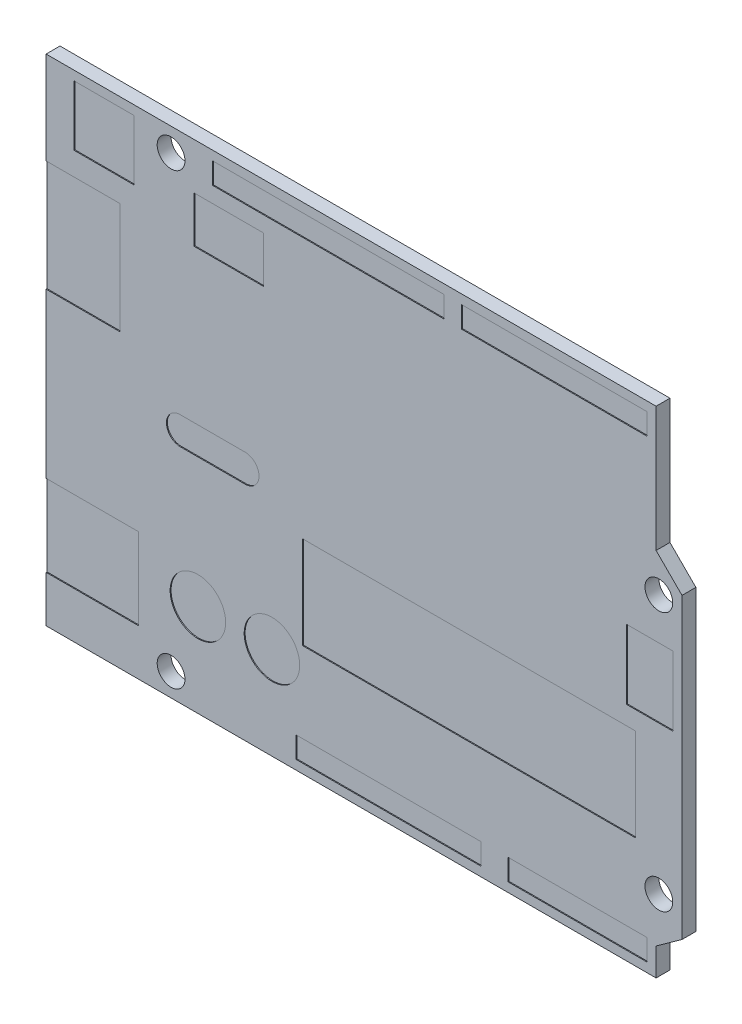
from build123d import *

# Parameters (mm, degrees)
ESQUISSE1_R             = 1.5
BOSS_EXTRU_1_DEPTH      = 1.5
ESQUISSE2_R             = 3
ESQUISSE2_W             = 6.5
ESQUISSE2_H             = 6.5
ESQUISSE2_W_2           = 36
ESQUISSE2_H_2           = 10
ESQUISSE2_W_3           = 5
ESQUISSE2_H_3           = 7.5
ESQUISSE2_W_4           = 20
ESQUISSE2_H_4           = 2.3
ESQUISSE2_W_5           = 15
ESQUISSE2_W_6           = 10.797288279
ESQUISSE2_H_5           = 8.8
ESQUISSE2_W_7           = 11.916291933
ESQUISSE2_H_6           = 12
ESQUISSE2_W_8           = 25
ESQUISSE2_W_9           = 7.5
ESQUISSE2_H_7           = 5
ENL_V_MAT_EXTRU_1_DEPTH = 0.1


with BuildPart() as part:
    # Esquisse1 → Boss.-Extru.1 (new body)
    with BuildSketch(Plane.XY):
        Polygon((35.75, 10.45), (35.75, -21.75), (32.95, -23.75), (32.95, -26.75), (-32.95, -26.75), (-32.95, 26.75), (32.95, 26.75), (32.95, 13.25), align=None)
        with Locations((33.25, 9.25)):
            Circle(ESQUISSE1_R, mode=Mode.SUBTRACT)
        with Locations((33.25, -18.75)):
            Circle(ESQUISSE1_R, mode=Mode.SUBTRACT)
        with Locations((-19.45, 24.25)):
            Circle(ESQUISSE1_R, mode=Mode.SUBTRACT)
        with Locations(Location((-19.45, -24.25, 0), (0, 0, 180))):
            Circle(ESQUISSE1_R, mode=Mode.SUBTRACT)
    extrude(amount=BOSS_EXTRU_1_DEPTH)

    # Esquisse2 → Enlèv. mat.-Extru.1 (cut)
    with BuildSketch(Plane.XY.offset(1.5)):
        with Locations((-16.55, -16.75)):
            Circle(ESQUISSE2_R)
        with Locations((-8.55, -16.75)):
            Circle(ESQUISSE2_R)
        with Locations((-26.7, 22.5)):
            Rectangle(ESQUISSE2_W, ESQUISSE2_H)
        with BuildLine():
            Line((-18.45, 0.25), (-11.45, 0.25))
            ThreePointArc((-11.45, 0.25), (-9.95, -1.25), (-11.45, -2.75))
            Line((-11.45, -2.75), (-18.45, -2.75))
            ThreePointArc((-18.45, -2.75), (-19.95, -1.25), (-18.45, 0.25))
        make_face()
        with Locations((12.75, -9.75)):
            Rectangle(ESQUISSE2_W_2, ESQUISSE2_H_2)
        with Locations((32.25, 1)):
            Rectangle(ESQUISSE2_W_3, ESQUISSE2_H_3)
        with Locations((4.05, -24.6)):
            Rectangle(ESQUISSE2_W_4, ESQUISSE2_H_4)
        with Locations((24.45, -24.6)):
            Rectangle(ESQUISSE2_W_5, ESQUISSE2_H_4)
        with Locations((-28.34864414, -17.35)):
            Rectangle(ESQUISSE2_W_6, ESQUISSE2_H_5)
        with Locations((-30.908145967, 10.75)):
            Rectangle(ESQUISSE2_W_7, ESQUISSE2_H_6)
        with Locations((-2.45, 24.6)):
            Rectangle(ESQUISSE2_W_8, ESQUISSE2_H_4)
        with Locations((21.95, 24.6)):
            Rectangle(ESQUISSE2_W_4, ESQUISSE2_H_4)
        with Locations((-13.2, 19.25)):
            Rectangle(ESQUISSE2_W_9, ESQUISSE2_H_7)
    extrude(amount=-ENL_V_MAT_EXTRU_1_DEPTH, mode=Mode.SUBTRACT)


solid = part.part
